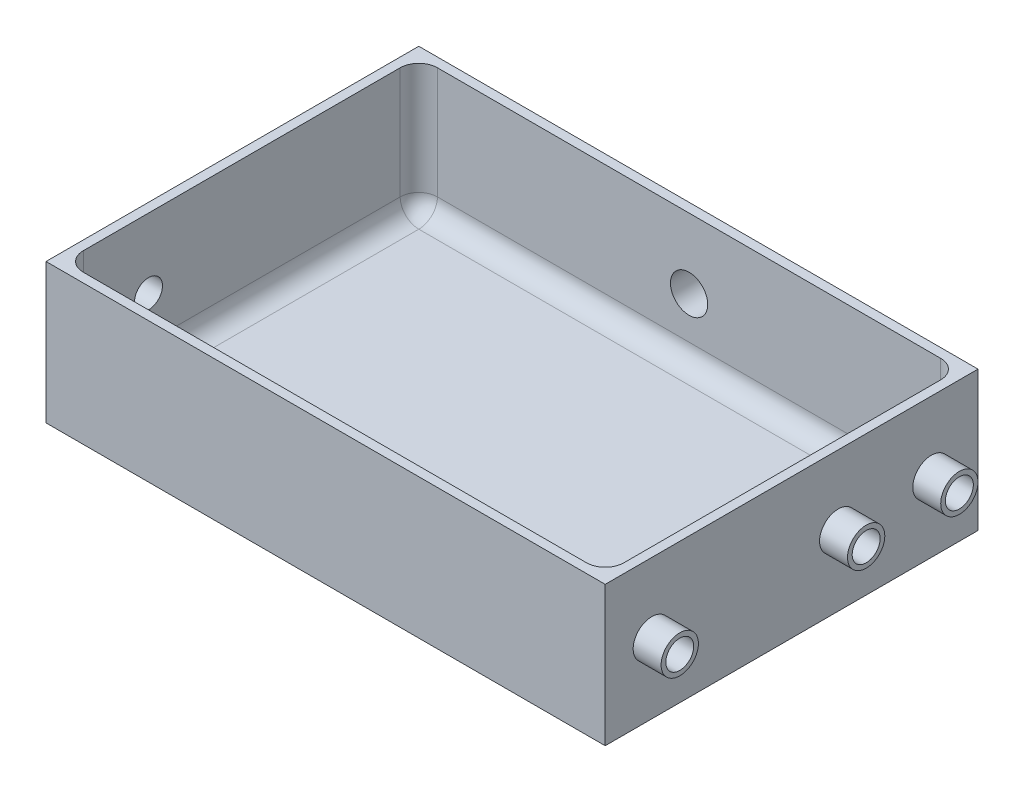
from build123d import *

# Parameters (mm, degrees)
SKETCH1_W           = 300
SKETCH1_H           = 200
BOSS_EXTRUDE1_DEPTH = 37.5
SHELL1_T            = -5
FILLET1_R           = 10
SKETCH2_R           = 7.5
CUT_EXTRUDE1_DEPTH  = 5
SKETCH3_R           = 7.5
CUT_EXTRUDE2_DEPTH  = 5
SKETCH4_R           = 10
CUT_EXTRUDE3_DEPTH  = 5
BOSS_EXTRUDE2_START = 15
SKETCH5_R           = 10
SKETCH5_R_2         = 7.5
BOSS_EXTRUDE2_DEPTH = 15
SKETCH6_R           = 10
SKETCH6_R_2         = 7.5
BOSS_EXTRUDE3_DEPTH = 15
SKETCH7_R           = 12.5
SKETCH7_R_2         = 10
BOSS_EXTRUDE4_DEPTH = 15


with BuildPart() as part:
    # Sketch1 → Boss-Extrude1 (new, symmetric)
    with BuildSketch(Plane(origin=(0, 0, 0), x_dir=(1, 0, 0), z_dir=(0, 1, 0))):
        Rectangle(SKETCH1_W, SKETCH1_H)
    extrude(amount=BOSS_EXTRUDE1_DEPTH, both=True)

    # Shell1
    shell1_openings = [part.faces().sort_by_distance(p)[0] for p in [
        (0, 37.5, 0),
    ]]
    offset(amount=SHELL1_T, openings=shell1_openings, kind=Kind.INTERSECTION)

    # Fillet1
    fillet1_edges = [part.edges().sort_by_distance(p)[0] for p in [
        (-145, -32.5, 0),
        (-145, 2.5, -95),
        (0, -32.5, 95),
        (-145, 2.5, 95),
        (145, -32.5, 0),
        (145, 2.5, 95),
        (0, -32.5, -95),
        (145, 2.5, -95),
    ]]
    fillet(fillet1_edges, radius=FILLET1_R)

    # Sketch2 → Cut-Extrude1 (cut)
    with BuildSketch(Plane(origin=(150, 0, 0), x_dir=(0, 0, -1), z_dir=(1, 0, 0))):
        with Locations((75, 0)):
            Circle(SKETCH2_R)
        with Locations((25, 0)):
            Circle(SKETCH2_R)
        with Locations((-75, 0)):
            Circle(SKETCH2_R)
    extrude(amount=-CUT_EXTRUDE1_DEPTH, mode=Mode.SUBTRACT)

    # Sketch3 → Cut-Extrude2 (cut)
    with BuildSketch(Plane(origin=(-145, 0, 0), x_dir=(0, 0, -1), z_dir=(1, 0, 0))):
        with Locations((-50, 0)):
            Circle(SKETCH3_R)
    extrude(amount=-CUT_EXTRUDE2_DEPTH, mode=Mode.SUBTRACT)

    # Sketch4 → Cut-Extrude3 (cut)
    with BuildSketch(Plane.XY.offset(-95)):
        Circle(SKETCH4_R)
    extrude(amount=-CUT_EXTRUDE3_DEPTH, mode=Mode.SUBTRACT)

    # Sketch5 → Boss-Extrude2 (add)
    # profile 1 of 3: a face of its own
    with BuildSketch(Plane(origin=(150, 0, 0), x_dir=(0, 0, -1), z_dir=(1, 0, 0)).offset(BOSS_EXTRUDE2_START)):
        with Locations(Location((-75, 0, 0), (0, 0, 180))):
            Circle(SKETCH5_R)
        with Locations((-75, 0)):
            Circle(SKETCH5_R_2, mode=Mode.SUBTRACT)
    # profile 2 of 3: a face of its own
    with BuildSketch(Plane(origin=(150, 0, 0), x_dir=(0, 0, -1), z_dir=(1, 0, 0)).offset(BOSS_EXTRUDE2_START)):
        with Locations(Location((25, 0, 0), (0, 0, 180))):
            Circle(SKETCH5_R)
        with Locations((25, 0)):
            Circle(SKETCH5_R_2, mode=Mode.SUBTRACT)
    # profile 3 of 3: a face of its own
    with BuildSketch(Plane(origin=(150, 0, 0), x_dir=(0, 0, -1), z_dir=(1, 0, 0)).offset(BOSS_EXTRUDE2_START)):
        with Locations(Location((75, 0, 0), (0, 0, 180))):
            Circle(SKETCH5_R)
        with Locations((75, 0)):
            Circle(SKETCH5_R_2, mode=Mode.SUBTRACT)
    extrude(amount=-BOSS_EXTRUDE2_DEPTH)

    # Sketch6 → Boss-Extrude3 (add)
    with BuildSketch(Plane.ZY.offset(150)):
        with Locations(Location((50, 0, 0), (0, 0, 180))):
            Circle(SKETCH6_R)
        with Locations(Location((50, 0, 0), (0, 0, 180))):
            Circle(SKETCH6_R_2, mode=Mode.SUBTRACT)
    extrude(amount=BOSS_EXTRUDE3_DEPTH)

    # Sketch7 → Boss-Extrude4 (add)
    with BuildSketch(Plane(origin=(0, 0, -100), x_dir=(-1, 0, 0), z_dir=(0, 0, -1))):
        with Locations(Location((0, 0, 0), (0, 0, 180))):
            Circle(SKETCH7_R)
        with Locations(Location((0, 0, 0), (0, 0, 180))):
            Circle(SKETCH7_R_2, mode=Mode.SUBTRACT)
    extrude(amount=BOSS_EXTRUDE4_DEPTH)


solid = part.part
